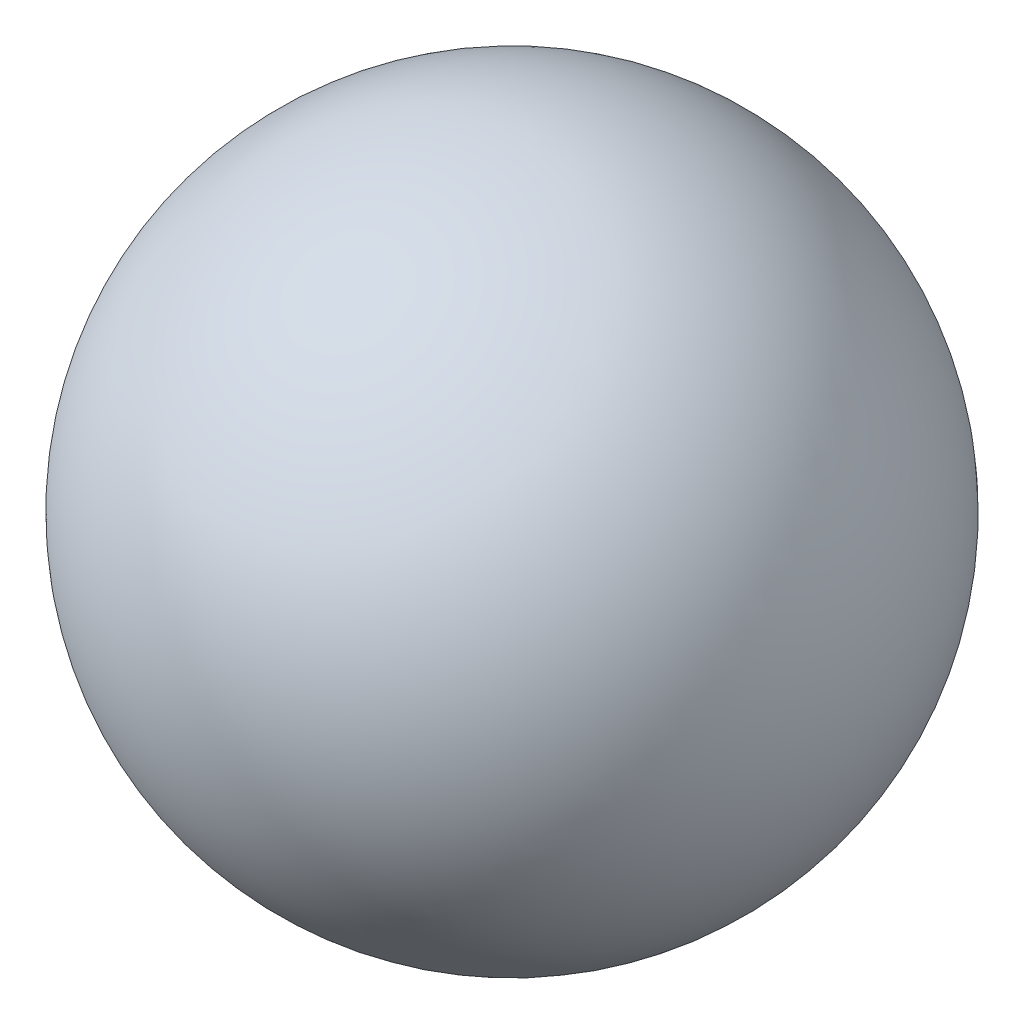
from build123d import *


with BuildPart() as part:
    # Sketch3 → Revolve1 (revolve)
    with BuildSketch(Plane(origin=(0, 0, 0), x_dir=(1, 0, 0), z_dir=(0, 1, 0))):
        with BuildLine():
            Line((0, 0), (-156.946390535, -199.709365073))
            ThreePointArc((-156.946390535, -199.709365073), (-178.327877804, -21.381487269), (0, 0))
        make_face()
    revolve(axis=Axis((-156.946390535, 0, 199.709365073), (0.6178991753352352, 0, -0.786257342808343)))


solid = part.part
